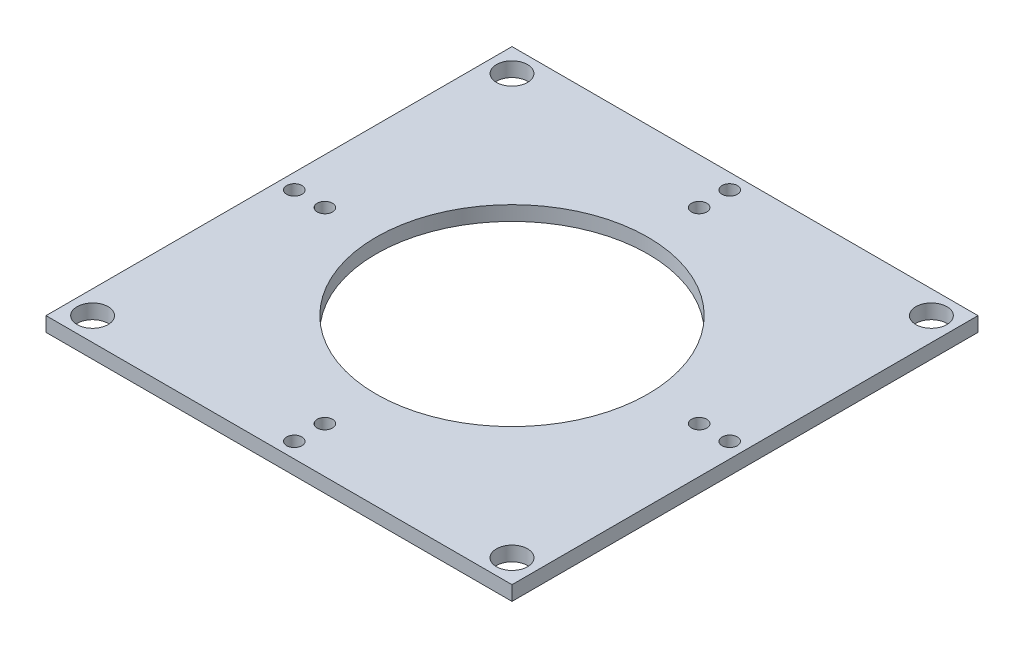
from build123d import *

# Parameters (mm, degrees)
SKETCH1_W           = 152.4
SKETCH1_H           = 152.4
SKETCH1_R           = 44.45
SKETCH1_R_2         = 2.5
SKETCH1_R_3         = 5.08
BOSS_EXTRUDE1_DEPTH = 4.7498


with BuildPart() as part:
    # Sketch1 → Boss-Extrude1 (new body)
    with BuildSketch(Plane(origin=(0, 0, 0), x_dir=(1, 0, 0), z_dir=(0, 1, 0))):
        Rectangle(SKETCH1_W, SKETCH1_H)
        with Locations(Location((0, 0, 0), (0, 0, 270))):
            Circle(SKETCH1_R, mode=Mode.SUBTRACT)
        with Locations(Location((0, -71.2, 0), (0, 0, 270))):
            Circle(SKETCH1_R_2, mode=Mode.SUBTRACT)
        with Locations(Location((0, -61.2, 0), (0, 0, 270))):
            Circle(SKETCH1_R_2, mode=Mode.SUBTRACT)
        with Locations(Location((-61.2, 0, 0), (0, 0, 270))):
            Circle(SKETCH1_R_2, mode=Mode.SUBTRACT)
        with Locations(Location((-71.2, 0, 0), (0, 0, 270))):
            Circle(SKETCH1_R_2, mode=Mode.SUBTRACT)
        with Locations(Location((0, 61.2, 0), (0, 0, 270))):
            Circle(SKETCH1_R_2, mode=Mode.SUBTRACT)
        with Locations(Location((0, 71.2, 0), (0, 0, 270))):
            Circle(SKETCH1_R_2, mode=Mode.SUBTRACT)
        with Locations(Location((61.2, 0, 0), (0, 0, 270))):
            Circle(SKETCH1_R_2, mode=Mode.SUBTRACT)
        with Locations(Location((71.2, 0, 0), (0, 0, 270))):
            Circle(SKETCH1_R_2, mode=Mode.SUBTRACT)
        with Locations(Location((-68.58, -68.58, 0), (0, 0, 270))):
            Circle(SKETCH1_R_3, mode=Mode.SUBTRACT)
        with Locations(Location((-68.58, 68.58, 0), (0, 0, 270))):
            Circle(SKETCH1_R_3, mode=Mode.SUBTRACT)
        with Locations(Location((68.58, 68.58, 0), (0, 0, 270))):
            Circle(SKETCH1_R_3, mode=Mode.SUBTRACT)
        with Locations(Location((68.58, -68.58, 0), (0, 0, 270))):
            Circle(SKETCH1_R_3, mode=Mode.SUBTRACT)
    extrude(amount=BOSS_EXTRUDE1_DEPTH)


solid = part.part
